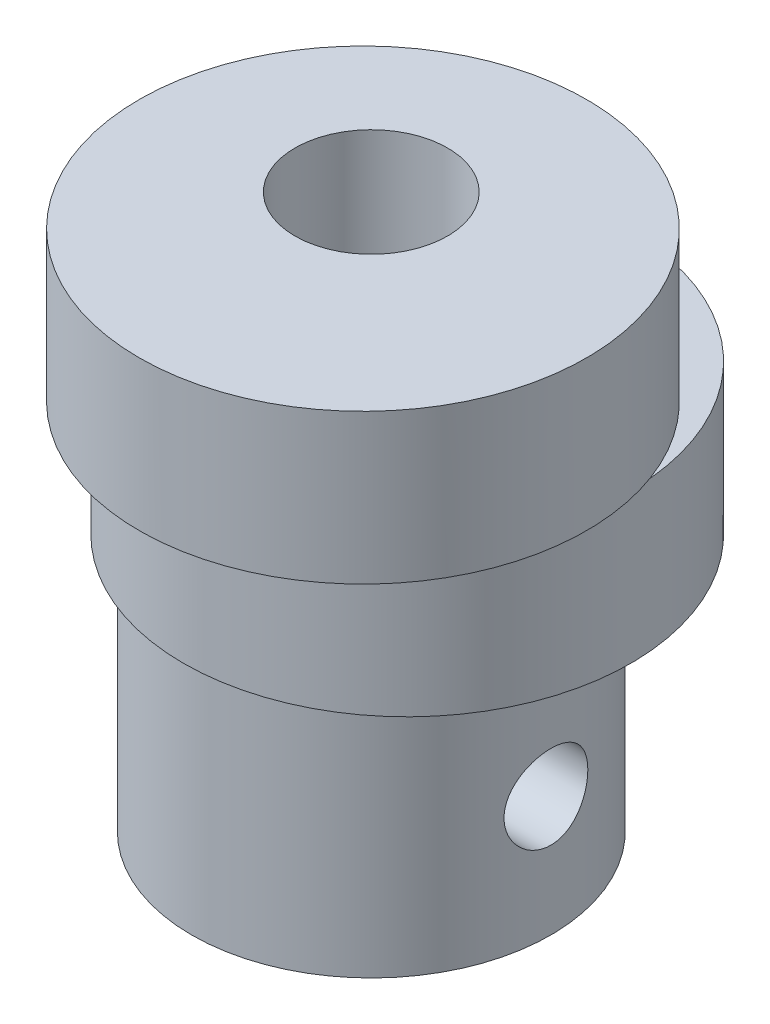
from build123d import *

# Parameters (mm, degrees)
SKETCH2_R              = 6
BASE_DEPTH             = 8
SKETCH3_R              = 7.475
CAM_A_DEPTH            = 5
SKETCH4_R              = 6
SPACER_DEPTH           = 0.5
SKETCH5_R              = 7.475
CAM_B_DEPTH            = 5
SKETCH6_R              = 2.55
SHAFT_HOLE_DEPTH       = 23.0907904
SCREW_HOLES_DEPTH      = 23.0907904
SCREW_HOLES_DEPTH_BACK = 23.0907904
SKETCH7_R              = 1.4


with BuildPart() as part:
    # Sketch2 → Base (new body)
    with BuildSketch(Plane(origin=(0, 0, 0), x_dir=(1, 0, 0), z_dir=(0, 1, 0))):
        with Locations(Location((0, 0, 0), (0, 0, 270))):
            Circle(SKETCH2_R)
    extrude(amount=BASE_DEPTH)

    # Sketch3 → Cam A (add)
    with BuildSketch(Plane(origin=(0, 8, 0), x_dir=(1, 0, 0), z_dir=(0, 1, 0))):
        with Locations(Location((0, 1.2, 0), (0, 0, 270))):
            Circle(SKETCH3_R)
    extrude(amount=CAM_A_DEPTH)

    # Sketch4 → Spacer (add)
    with BuildSketch(Plane(origin=(0, 13, 0), x_dir=(1, 0, 0), z_dir=(0, 1, 0))):
        with Locations(Location((0, 0, 0), (0, 0, 270))):
            Circle(SKETCH4_R)
    extrude(amount=SPACER_DEPTH)

    # Sketch5 → Cam B (add)
    with BuildSketch(Plane(origin=(0, 13.5, 0), x_dir=(1, 0, 0), z_dir=(0, 1, 0))):
        with Locations(Location((0.921272716, -1.2, 0), (0, 0, 116.029296009))):
            Circle(SKETCH5_R)
    extrude(amount=CAM_B_DEPTH)

    # Sketch6 → Shaft Hole (cut, through all)
    with BuildSketch(Plane(origin=(0, 18.5, 0), x_dir=(1, 0, 0), z_dir=(0, 1, 0))):
        with Locations(Location((0, 0, 0), (0, 0, 270))):
            Circle(SKETCH6_R)
    extrude(amount=-SHAFT_HOLE_DEPTH, mode=Mode.SUBTRACT)

    # Sketch7 → Screw Holes (cut, two sides: drawn at the far end of the back side and taken through both)
    with BuildSketch(Plane(origin=(0, 0, 0), x_dir=(0, 0, -1), z_dir=(1, 0, 0)).offset(-SCREW_HOLES_DEPTH_BACK)):
        with Locations((0, 4)):
            Circle(SKETCH7_R)
    extrude(amount=SCREW_HOLES_DEPTH + SCREW_HOLES_DEPTH_BACK, mode=Mode.SUBTRACT)


solid = part.part
